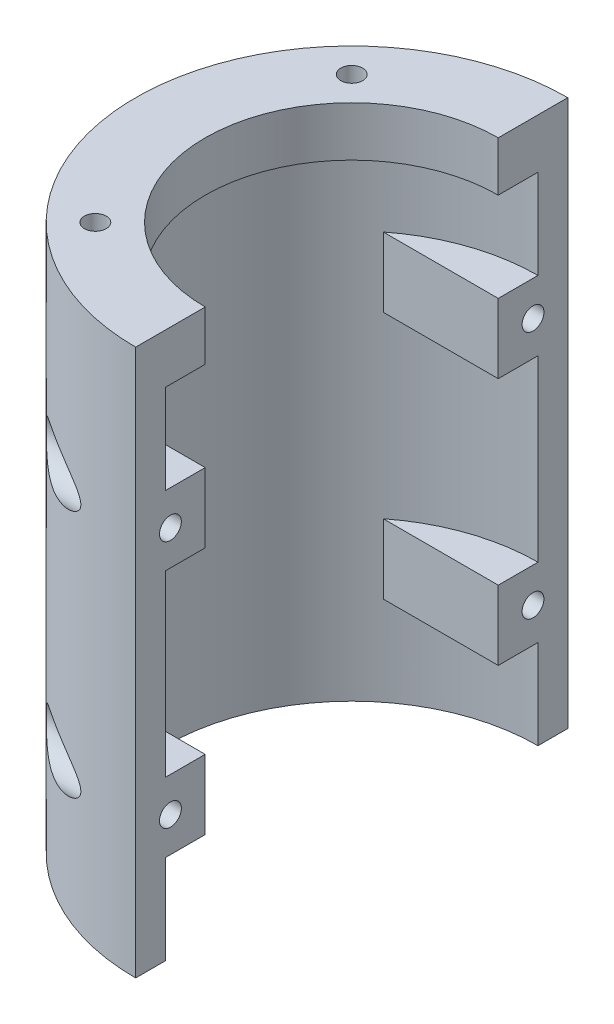
from build123d import *

# Parameters (mm, degrees)
EXTRUDE_1_DEPTH      = 55
CUT_EXTRUDE_START    = -5
SKETCH_2_R           = 18.75
SKETCH_2_R_2         = 14.75
CUT_EXTRUDE_1_DEPTH  = 59.016862823
EXTRUDE_3_REACH      = 65.017
EXTRUDE_3_END_RADIUS = 18.75
SKETCH_4_W           = 7
SKETCH_4_H           = 7
SKETCH_3_R           = 1.1
CUT_EXTRUDE_2_DEPTH  = 5
CUT_EXTRUDE_START_2  = -4
SKETCH_5_R           = 2.5
CUT_EXTRUDE_3_DEPTH  = 60.016862823
SKETCH_6_R           = 1.1
CUT_EXTRUDE_4_DEPTH  = 4


with BuildPart() as part:
    # ｽｹｯﾁ1 → ﾎﾞｽ - 押し出し1 (new body)
    with BuildSketch(Plane(origin=(0, 0, 0), x_dir=(1, 0, 0), z_dir=(0, 1, 0))):
        with BuildLine():
            Line((0, -21.75), (0, -14.75))
            ThreePointArc((0, -14.75), (-14.75, 0), (0, 14.75))
            Line((0, 14.75), (0, 21.75))
            ThreePointArc((0, 21.75), (-21.75, 0), (0, -21.75))
        make_face()
    extrude(amount=EXTRUDE_1_DEPTH)

    # ｽｹｯﾁ2 → ｶｯﾄ - 押し出し1 (cut, through all)
    with BuildSketch(Plane(origin=(0, 55, 0), x_dir=(1, 0, 0), z_dir=(0, 1, 0)).offset(CUT_EXTRUDE_START)):
        Circle(SKETCH_2_R)
        Circle(SKETCH_2_R_2, mode=Mode.SUBTRACT)
    extrude(amount=-CUT_EXTRUDE_1_DEPTH, mode=Mode.SUBTRACT)

    # ﾎﾞｽ - 押し出し3: up to this cylinder (the profile starts inside it)
    extrude_3_end = Plane(origin=(0, 25, 0), z_dir=(0, 1, 0)) * Cylinder(EXTRUDE_3_END_RADIUS, 193.534, mode=Mode.PRIVATE)
    # ｽｹｯﾁ4 → ﾎﾞｽ - 押し出し3 (add, up to the surface)
    with BuildSketch(Plane(origin=(0, 0, 0), x_dir=(0, 0, -1), z_dir=(1, 0, 0)), mode=Mode.PRIVATE) as extrude_3_sk1:
        with Locations((-18.25, 37.5)):
            Rectangle(SKETCH_4_W, SKETCH_4_H)
    extrude_3_tool1 = extrude(extrude_3_sk1.sketch, amount=-EXTRUDE_3_REACH, mode=Mode.PRIVATE) & extrude_3_end
    add(extrude_3_tool1.solids().sort_by_distance((0, 37.5, 18.25))[0])
    # ｽｹｯﾁ4 → ﾎﾞｽ - 押し出し3 (add, up to the surface)
    with BuildSketch(Plane(origin=(0, 0, 0), x_dir=(0, 0, -1), z_dir=(1, 0, 0)), mode=Mode.PRIVATE) as extrude_3_sk2:
        with Locations((-18.25, 12.5)):
            Rectangle(SKETCH_4_W, SKETCH_4_H)
    extrude_3_tool2 = extrude(extrude_3_sk2.sketch, amount=-EXTRUDE_3_REACH, mode=Mode.PRIVATE) & extrude_3_end
    add(extrude_3_tool2.solids().sort_by_distance((0, 12.5, 18.25))[0])
    # ｽｹｯﾁ4 → ﾎﾞｽ - 押し出し3 (add, up to the surface)
    with BuildSketch(Plane(origin=(0, 0, 0), x_dir=(0, 0, -1), z_dir=(1, 0, 0)), mode=Mode.PRIVATE) as extrude_3_sk3:
        with Locations((18.25, 12.5)):
            Rectangle(SKETCH_4_W, SKETCH_4_H)
    extrude_3_tool3 = extrude(extrude_3_sk3.sketch, amount=-EXTRUDE_3_REACH, mode=Mode.PRIVATE) & extrude_3_end
    add(extrude_3_tool3.solids().sort_by_distance((0, 12.5, -18.25))[0])
    # ｽｹｯﾁ4 → ﾎﾞｽ - 押し出し3 (add, up to the surface)
    with BuildSketch(Plane(origin=(0, 0, 0), x_dir=(0, 0, -1), z_dir=(1, 0, 0)), mode=Mode.PRIVATE) as extrude_3_sk4:
        with Locations((18.25, 37.5)):
            Rectangle(SKETCH_4_W, SKETCH_4_H)
    extrude_3_tool4 = extrude(extrude_3_sk4.sketch, amount=-EXTRUDE_3_REACH, mode=Mode.PRIVATE) & extrude_3_end
    add(extrude_3_tool4.solids().sort_by_distance((0, 37.5, -18.25))[0])

    # ｽｹｯﾁ3 → ｶｯﾄ - 押し出し2 (cut)
    with BuildSketch(Plane(origin=(0, 0, 0), x_dir=(0, 0, -1), z_dir=(1, 0, 0))):
        with Locations((-18.25, 37.5)):
            Circle(SKETCH_3_R)
        with Locations(Location((18.25, 37.5, 0), (0, 0, 180))):
            Circle(SKETCH_3_R)
        with Locations((18.25, 12.5)):
            Circle(SKETCH_3_R)
        with Locations(Location((-18.25, 12.5, 0), (0, 0, 180))):
            Circle(SKETCH_3_R)
    extrude(amount=-CUT_EXTRUDE_2_DEPTH, mode=Mode.SUBTRACT)

    # ｽｹｯﾁ5 → ｶｯﾄ - 押し出し3 (cut, through all)
    with BuildSketch(Plane(origin=(0, 0, 0), x_dir=(0, 0, -1), z_dir=(1, 0, 0)).offset(CUT_EXTRUDE_START_2)):
        with Locations((-18.25, 37.5)):
            Circle(SKETCH_5_R)
        with Locations((-18.25, 12.5)):
            Circle(SKETCH_5_R)
        with Locations((18.25, 12.5)):
            Circle(SKETCH_5_R)
        with Locations((18.25, 37.5)):
            Circle(SKETCH_5_R)
    extrude(amount=-CUT_EXTRUDE_3_DEPTH, mode=Mode.SUBTRACT)

    # ｽｹｯﾁ6 → ｶｯﾄ - 押し出し4 (cut)
    with BuildSketch(Plane(origin=(0, 55, 0), x_dir=(1, 0, 0), z_dir=(0, 1, 0))):
        with Locations(Location((-12.904698757, -12.904698757, 0), (0, 0, 270))):
            Circle(SKETCH_6_R)
        with Locations(Location((-12.904698757, 12.904698757, 0), (0, 0, 270))):
            Circle(SKETCH_6_R)
    extrude(amount=-CUT_EXTRUDE_4_DEPTH, mode=Mode.SUBTRACT)


solid = part.part
